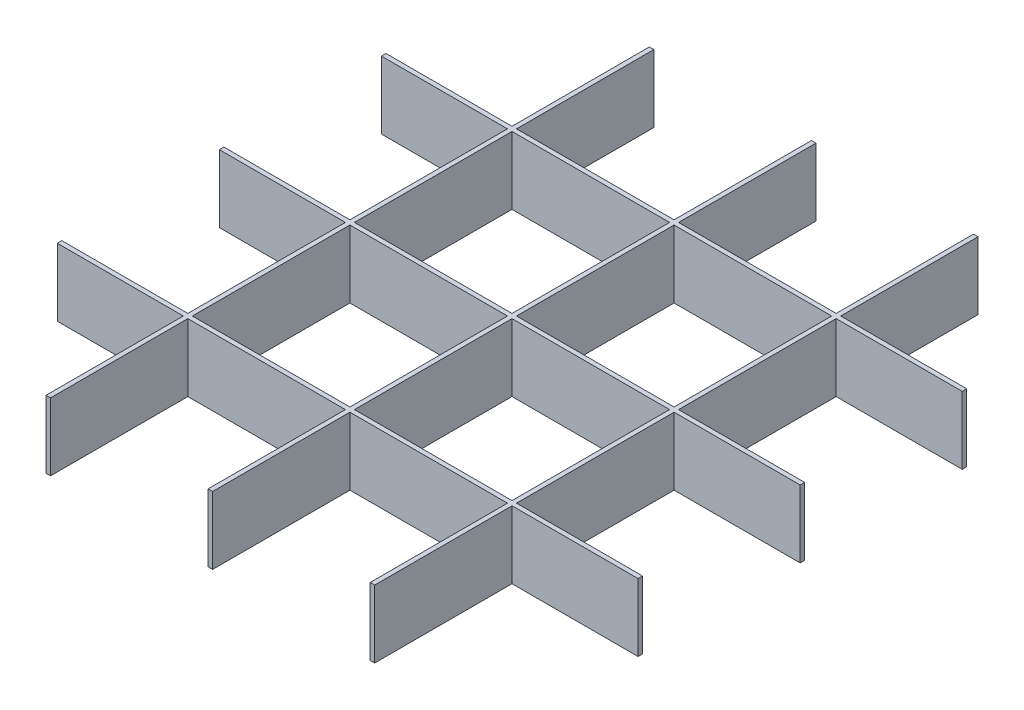
from build123d import *

# Parameters (mm, degrees)
SKETCH_1_W      = 70
SKETCH_1_H      = 70
EXTRUDE_2_DEPTH = 30


with BuildPart() as part:
    # 草图1 → 凸台-拉伸2 (new body)
    with BuildSketch(Plane(origin=(0, 0, 0), x_dir=(1, 0, 0), z_dir=(0, 1, 0))):
        Polygon((-71, 73), (-1, 73), (-1, 134), (1, 134), (1, 73), (71, 73), (71, 134), (73, 134), (73, 73), (129, 73), (129, 71), (73, 71), (73, 1), (129, 1), (129, -1), (73, -1), (73, -71), (129, -71), (129, -73), (73, -73), (73, -134), (71, -134), (71, -73), (1, -73), (1, -134), (-1, -134), (-1, -73), (-71, -73), (-71, -134), (-73, -134), (-73, -73), (-129, -73), (-129, -71), (-73, -71), (-73, -1), (-129, -1), (-129, 1), (-73, 1), (-73, 71), (-129, 71), (-129, 73), (-73, 73), (-73, 134), (-71, 134), align=None)
        with Locations((-36, 36)):
            Rectangle(SKETCH_1_W, SKETCH_1_H, mode=Mode.SUBTRACT)
        with Locations((-36, -36)):
            Rectangle(SKETCH_1_W, SKETCH_1_H, mode=Mode.SUBTRACT)
        with Locations((36, -36)):
            Rectangle(SKETCH_1_W, SKETCH_1_H, mode=Mode.SUBTRACT)
        with Locations((36, 36)):
            Rectangle(SKETCH_1_W, SKETCH_1_H, mode=Mode.SUBTRACT)
    extrude(amount=EXTRUDE_2_DEPTH)


solid = part.part
